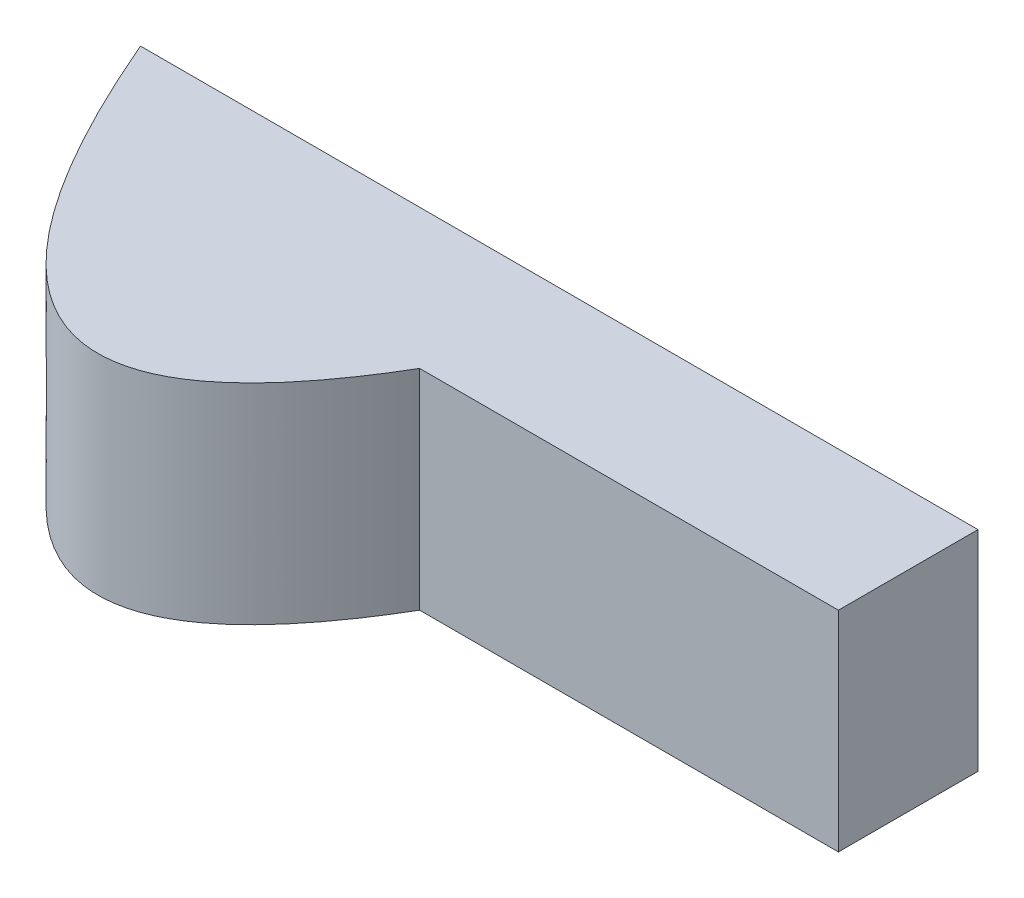
from build123d import *

# Parameters (mm, degrees)
SALIENTE_EXTRUIR5_DEPTH = 30
CORTAR_EXTRUIR3_START   = -2.5
CORTAR_EXTRUIR3_DEPTH   = 140.62670419


with BuildPart() as part:
    # Croquis2 → Saliente-Extruir5 (new body)
    with BuildSketch(Plane(origin=(0, 0, 0), x_dir=(1, 0, 0), z_dir=(0, 1, 0))):
        with BuildLine():
            Line((-60, 70), (-120, 70))
            add(Edge.make_bspline(
                [(-120, 70), (-89.713167171, -0.733691908), (-60, 50)],
                knots=[0, 0, 0, 1, 1, 1], degree=2))
            Line((-60, 50), (0, 50))
            Line((0, 50), (0, 70))
            Line((0, 70), (-60, 70))
        make_face()
    extrude(amount=SALIENTE_EXTRUIR5_DEPTH)

    # Croquis6 → Cortar-Extruir3 (cut, through all)
    with BuildSketch(Plane(origin=(0, 30, 0), x_dir=(1, 0, 0), z_dir=(0, 1, 0)).offset(CORTAR_EXTRUIR3_START)):
        with BuildLine():
            Line((-61.443608846, 52.5), (-2.5, 52.5))
            Line((-2.5, 52.5), (-2.5, 67.5))
            Line((-2.5, 67.5), (-116.177064023, 67.5))
            add(Edge.make_bspline(
                [(-116.177064023, 67.5), (-114.771949279, 64.36029718), (-113.298573184, 61.260952171), (-110.159197746, 55.176145812), (-108.494822806, 52.189724076), (-105.774709206, 47.842260502), (-104.830277833, 46.415411024), (-102.84047971, 43.621387577), (-101.795600134, 42.253925578), (-100.120108367, 40.266686798), (-99.542667673, 39.614451444), (-98.354918015, 38.34961794), (-97.743462298, 37.735507144), (-96.477317691, 36.552301744), (-95.822698231, 35.983134847), (-94.458482086, 34.90204564), (-93.754263765, 34.394646732), (-92.3006624, 33.469003582), (-91.550079072, 33.049597651), (-90.378524873, 32.503876968), (-89.980353401, 32.335941503), (-89.166392132, 32.03223314), (-88.748175399, 31.895869396), (-87.485221486, 31.548664142), (-86.631979489, 31.398555215), (-85.33330058, 31.309196309), (-84.896827736, 31.302062963), (-84.019122286, 31.335175348), (-83.585082186, 31.375092766), (-82.296447109, 31.560304367), (-81.455315589, 31.770952245), (-80.216992234, 32.200384688), (-79.808755024, 32.362438708), (-79.013463711, 32.714675587), (-78.624438583, 32.905503689), (-77.479889065, 33.51642508), (-76.746737647, 33.974694553), (-75.327341507, 34.97127288), (-74.638588887, 35.512159344), (-72.660147986, 37.205526196), (-71.447730367, 38.431624015), (-69.158190303, 41.007233467), (-68.082268078, 42.357839921), (-66.541849459, 44.45076279), (-66.040847863, 45.159753109), (-65.064206831, 46.591540977), (-64.587998187, 47.31511405), (-63.190803125, 49.505760993), (-62.3010242, 50.992620961), (-61.443608846, 52.5)],
                knots=[0, 0, 0, 0, 0.125, 0.125, 0.25, 0.25, 0.3125, 0.3125, 0.375, 0.375, 0.40625, 0.40625, 0.4375, 0.4375, 0.46875, 0.46875, 0.5, 0.5, 0.53125, 0.53125, 0.546875, 0.546875, 0.5625, 0.5625, 0.59375, 0.59375, 0.609375, 0.609375, 0.625, 0.625, 0.65625, 0.65625, 0.671875, 0.671875, 0.6875, 0.6875, 0.71875, 0.71875, 0.75, 0.75, 0.8125, 0.8125, 0.875, 0.875, 0.90625, 0.90625, 0.9375, 0.9375, 1, 1, 1, 1], degree=3))
        make_face()
    extrude(amount=-CORTAR_EXTRUIR3_DEPTH, mode=Mode.SUBTRACT)


solid = part.part
